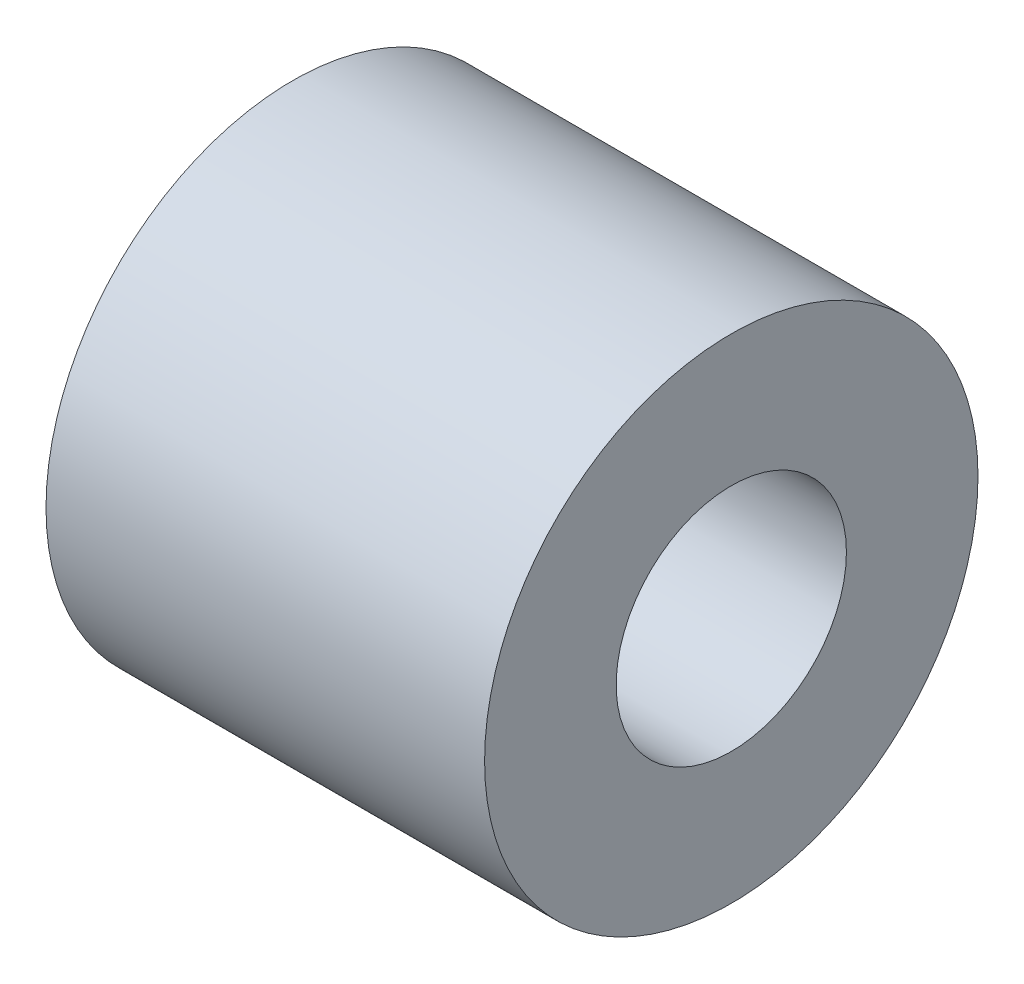
from build123d import *

# Parameters (mm, degrees)
SKETCH1_W = 40
SKETCH1_H = 12


with BuildPart() as part:
    # Sketch1 → Revolve1 (revolve)
    with BuildSketch(Plane.XY, mode=Mode.PRIVATE) as revolve1_sk:
        with Locations((-20, 16.5)):
            Rectangle(SKETCH1_W, SKETCH1_H)
    revolve(revolve1_sk.sketch.rotate(Axis((0, 0, 0), (-1, 0, 0)), 90), axis=Axis((0, 0, 0), (-1, 0, 0)))


solid = part.part
